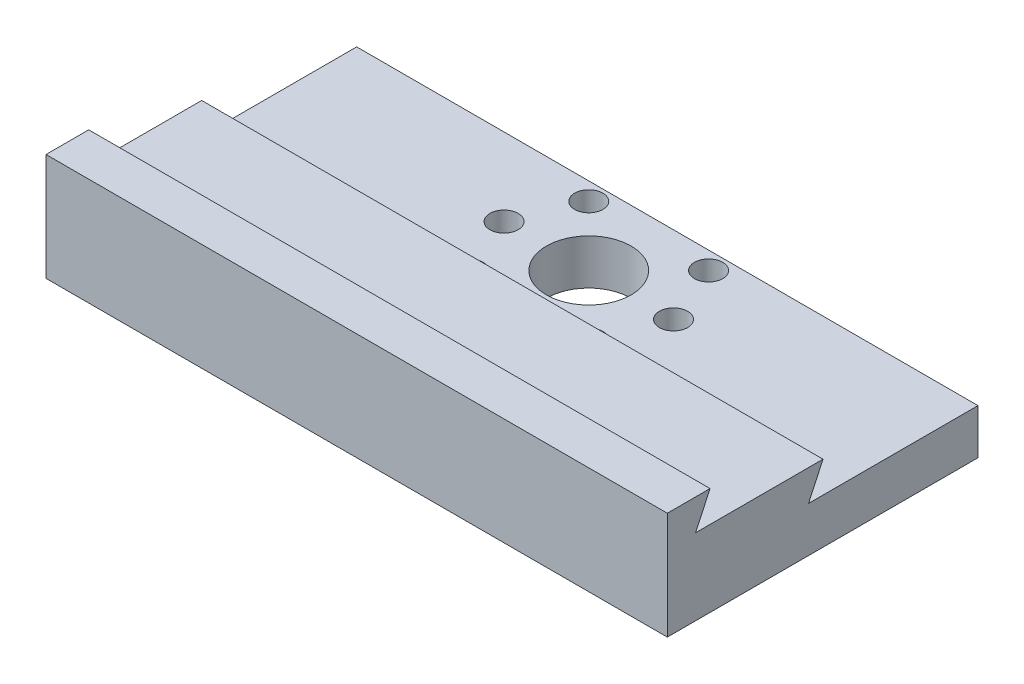
from build123d import *

# Parameters (mm, degrees)
BOSS_EXTRUDE1_DEPTH = 110
SKETCH2_R           = 2
M_DRILL_DEPTH       = 20
SKETCH6_R           = 7.5
CUT_EXTRUDE2_DEPTH  = 10
SKETCH8_R           = 2.504958384
CUT_EXTRUDE3_DEPTH  = 10
CIRPATTERN1_COUNT   = 8


with BuildPart() as part:
    # Sketch1 → Boss-Extrude1 (new body)
    with BuildSketch(Plane(origin=(0, 0, 0), x_dir=(0, 0, -1), z_dir=(1, 0, 0))):
        Polygon((0, 0), (0, 19), (7.56469212, 19), (5, 13.5), (27.56469212, 13.5), (25, 8), (55, 8), (55, 0), align=None)
    extrude(amount=BOSS_EXTRUDE1_DEPTH)

    # Sketch2 → M$_DRILL (cut)
    with BuildSketch(Plane(origin=(0, 0, -55), x_dir=(-1, 0, 0), z_dir=(0, 0, -1))):
        with Locations((-20.948830341, 4.5)):
            Circle(SKETCH2_R)
        with Locations(Location((-89.051169659, 4.5, 0), (0, 0, 180))):
            Circle(SKETCH2_R)
    extrude(amount=-M_DRILL_DEPTH, mode=Mode.SUBTRACT)

    # Sketch6 → Cut-Extrude2 (cut)
    with BuildSketch(Plane(origin=(0, 8, 0), x_dir=(1, 0, 0), z_dir=(0, 1, 0))):
        with Locations(Location((54.829568948, 41.26029258, 0), (0, 0, 270))):
            Circle(SKETCH6_R)
    extrude(amount=-CUT_EXTRUDE2_DEPTH, mode=Mode.SUBTRACT)

    # Sketch8 → Cut-Extrude3 (cut)
    with BuildSketch(Plane(origin=(0, 8, 0), x_dir=(1, 0, 0), z_dir=(0, 1, 0))):
        with Locations(Location((39.829568948, 41.26029258, 0), (0, 0, 270))):
            Circle(SKETCH8_R)
    cut_extrude3 = extrude(amount=-CUT_EXTRUDE3_DEPTH, mode=Mode.SUBTRACT)

    # CirPattern1: Cut-Extrude3 ×8 about axis, 2 skipped
    cirpattern1_axis = Axis((54.829568948, 0, -41.26029258), (0, 1, 0))
    add([cut_extrude3.rotate(cirpattern1_axis, i * 360 / CIRPATTERN1_COUNT) for i in range(1, CIRPATTERN1_COUNT) if i not in (2, 6)], mode=Mode.SUBTRACT)


solid = part.part
